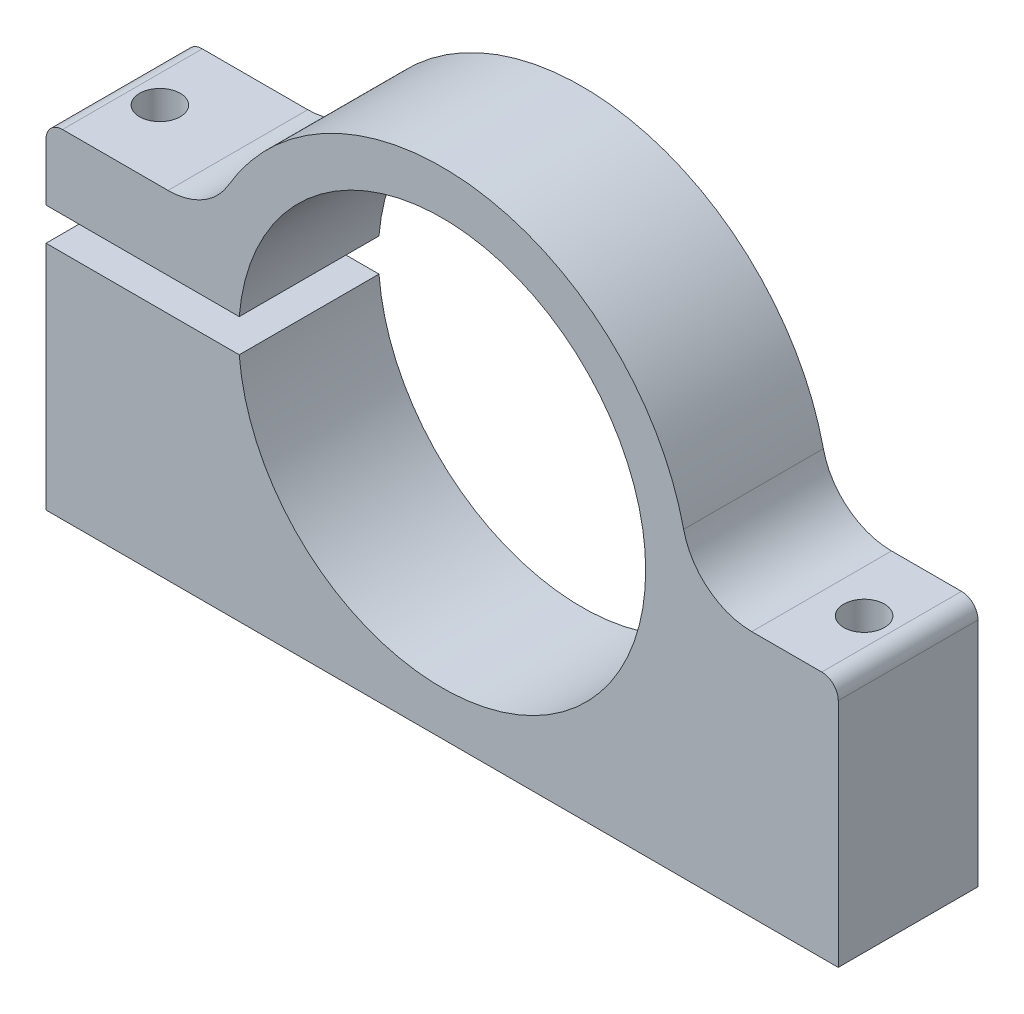
from build123d import *

# Parameters (mm, degrees)
BOSS_EXTRUDE1_DEPTH            = 12.7
CUT_EXTRUDE1_DEPTH             = 45.311849431
SKETCH3_W                      = 18.5
SKETCH3_H                      = 12.7
F_3_7_3_7_DIAMETER_HOLE1_D     = 3.7
F_3_7_3_7_DIAMETER_HOLE1_DEPTH = 6.7
F_3_7_3_7_DIAMETER_HOLE2_D     = 3.7
F_3_7_3_7_DIAMETER_HOLE2_DEPTH = 45
F_3_7_3_7_DIAMETER_HOLE3_D     = 3.7
F_3_7_3_7_DIAMETER_HOLE3_DEPTH = 45
FILLET1_R                      = 1.5
FILLET2_R                      = 6.35


with BuildPart() as part:
    # Sketch1 → Boss-Extrude1 (new body)
    with BuildSketch(Plane.XY.offset(6.35)):
        with BuildLine():
            Line((-20.952565475, 8.2), (-36, 8.2))
            Line((-36, 8.2), (-36, -22.5))
            Line((-36, -22.5), (36, -22.5))
            Line((36, -22.5), (36, 0))
            Line((36, 0), (22.5, 0))
            ThreePointArc((22.5, 0), (4.172366044, 22.109757158), (-20.952565475, 8.2))
        make_face()
    extrude(amount=-BOSS_EXTRUDE1_DEPTH)

    # Sketch2 → Cut-Extrude1 (cut, through all)
    with BuildSketch(Plane(origin=(0, 0, -6.35), x_dir=(-1, 0, 0), z_dir=(0, 0, -1))):
        with BuildLine():
            Line((36, 1.5), (18.439088915, 1.5))
            ThreePointArc((18.439088915, 1.5), (18.5, 0), (18.439088915, -1.5))
            Line((18.439088915, -1.5), (36, -1.5))
            Line((36, -1.5), (36, 1.5))
        make_face()
    extrude(amount=-CUT_EXTRUDE1_DEPTH, mode=Mode.SUBTRACT)

    # Sketch3 → Cut-Revolve1 (revolve, cut)
    with BuildSketch(Plane(origin=(0, 0, 0), x_dir=(1, 0, 0), z_dir=(0, 1, 0))):
        with Locations((9.25, 0)):
            Rectangle(SKETCH3_W, SKETCH3_H)
    revolve(axis=Axis((0, 0, -6.35), (0, 0, 1)), mode=Mode.SUBTRACT)

    # Ø3.7 (3.7) Diameter Hole1
    with Locations(Plane(origin=(0, 8.2, 0), x_dir=(1, 0, 0), z_dir=(0, 1, 0))):
        with Locations((-32, 0)):
            Hole(F_3_7_3_7_DIAMETER_HOLE1_D / 2, depth=F_3_7_3_7_DIAMETER_HOLE1_DEPTH)

    # Ø3.7 (3.7) Diameter Hole2
    with Locations(Plane(origin=(0, -22.5, 0), x_dir=(-1, 0, 0), z_dir=(0, -1, 0))):
        with Locations((32, 0)):
            Hole(F_3_7_3_7_DIAMETER_HOLE2_D / 2, depth=F_3_7_3_7_DIAMETER_HOLE2_DEPTH)

    # Ø3.7 (3.7) Diameter Hole3
    with Locations(Plane(origin=(0, -22.5, 0), x_dir=(-1, 0, 0), z_dir=(0, -1, 0))):
        with Locations((-32, 0)):
            Hole(F_3_7_3_7_DIAMETER_HOLE3_D / 2, depth=F_3_7_3_7_DIAMETER_HOLE3_DEPTH)

    # Fillet1
    fillet1_edges = [part.edges().sort_by_distance(p)[0] for p in [
        (36, 0, 0),
        (-36, 8.2, 0),
    ]]
    fillet(fillet1_edges, radius=FILLET1_R)

    # Fillet2
    fillet2_edges = [part.edges().sort_by_distance(p)[0] for p in [
        (22.5, 0, 0),
        (-20.952565475, 8.2, 0),
    ]]
    fillet(fillet2_edges, radius=FILLET2_R)


solid = part.part
